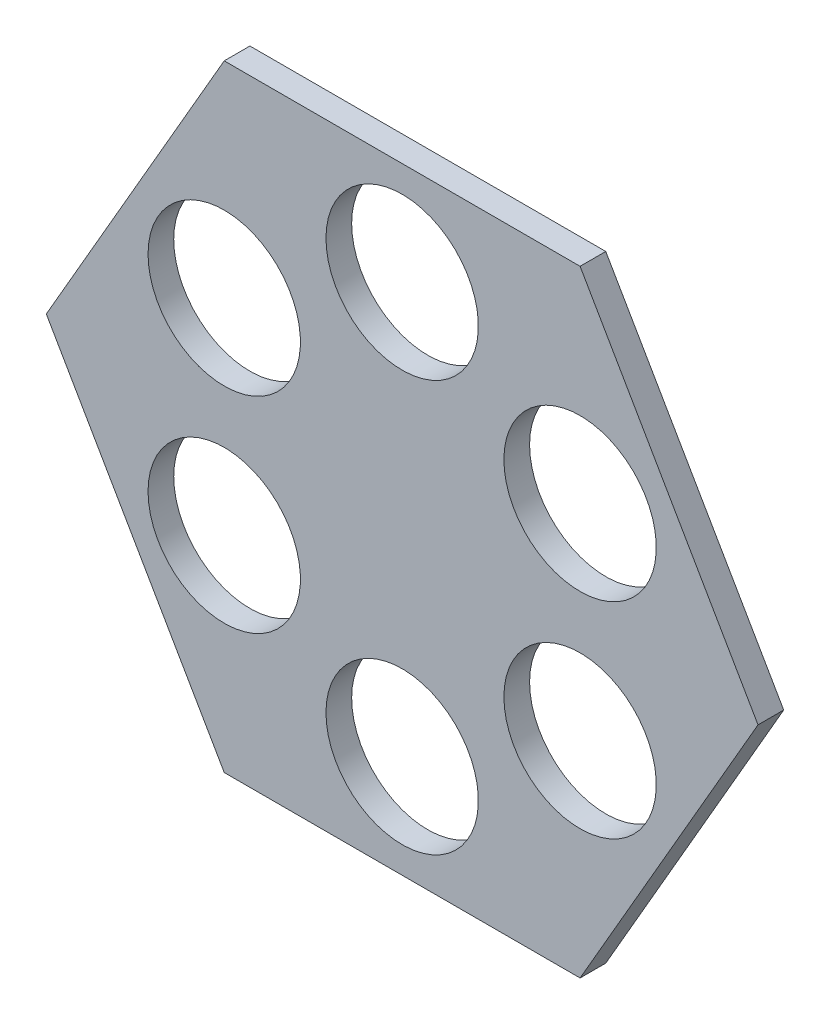
from build123d import *

# Parameters (mm, degrees)
SKETCH1_R           = 56.515
BOSS_EXTRUDE1_DEPTH = 19.05


with BuildPart() as part:
    # Sketch1 → Boss-Extrude1 (new body)
    # profile 1 of 6: a face of its own
    with BuildSketch(Plane.XY):
        Polygon((-263.964543073, 0), (-131.982271537, 228.6), (0, 0), align=None)
        with Locations(Location((-131.982271537, 76.2, 0), (0, 0, 180))):
            Circle(SKETCH1_R, mode=Mode.SUBTRACT)
    # profile 2 of 6: a face of its own
    with BuildSketch(Plane.XY):
        Polygon((131.982271537, 228.6), (0, 0), (-131.982271537, 228.6), align=None)
        with Locations(Location((0, 152.4, 0), (0, 0, 180))):
            Circle(SKETCH1_R, mode=Mode.SUBTRACT)
    # profile 3 of 6: a face of its own
    with BuildSketch(Plane.XY):
        Polygon((263.964543073, 0), (0, 0), (131.982271537, 228.6), align=None)
        with Locations(Location((131.982271537, 76.2, 0), (0, 0, 180))):
            Circle(SKETCH1_R, mode=Mode.SUBTRACT)
    # profile 4 of 6: a face of its own
    with BuildSketch(Plane.XY):
        Polygon((131.982271537, -228.6), (0, 0), (263.964543073, 0), align=None)
        with Locations(Location((131.982271537, -76.2, 0), (0, 0, 180))):
            Circle(SKETCH1_R, mode=Mode.SUBTRACT)
    # profile 5 of 6: a face of its own
    with BuildSketch(Plane.XY):
        Polygon((-131.982271537, -228.6), (0, 0), (131.982271537, -228.6), align=None)
        with Locations(Location((0, -152.4, 0), (0, 0, 180))):
            Circle(SKETCH1_R, mode=Mode.SUBTRACT)
    # profile 6 of 6: a face of its own
    with BuildSketch(Plane.XY):
        Polygon((-263.964543073, 0), (0, 0), (-131.982271537, -228.6), align=None)
        with Locations(Location((-131.982271537, -76.2, 0), (0, 0, 180))):
            Circle(SKETCH1_R, mode=Mode.SUBTRACT)
    extrude(amount=BOSS_EXTRUDE1_DEPTH)


solid = part.part
